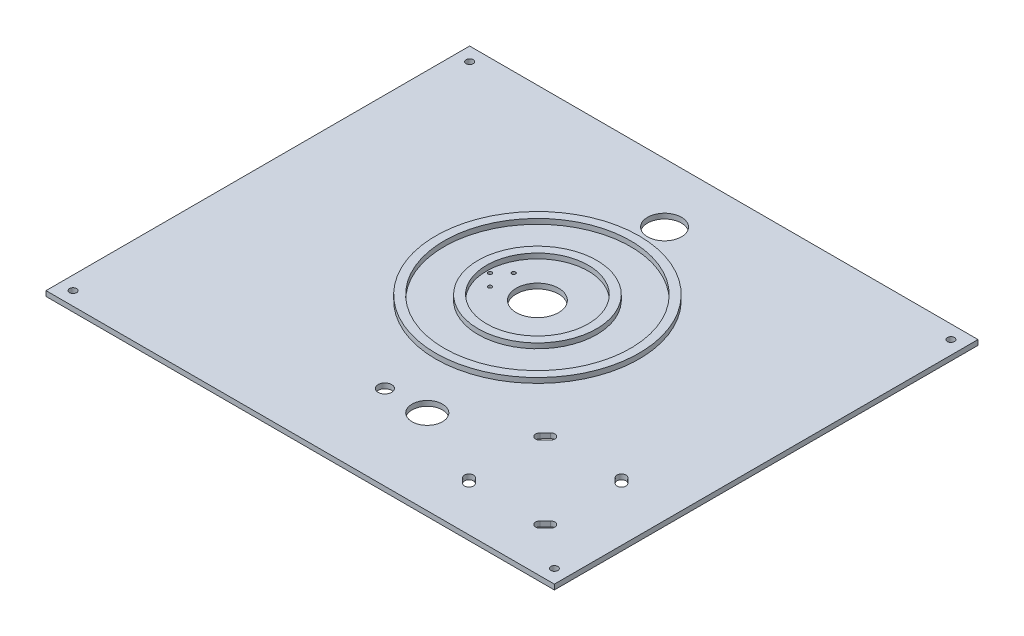
from build123d import *

# Parameters (mm, degrees)
SKETCH1_W           = 300
SKETCH1_H           = 220
BOSS_EXTRUDE1_DEPTH = 3
SKETCH2_R           = 12.5
CUT_EXTRUDE1_DEPTH  = 3
SKETCH3_R           = 60
SKETCH3_R_2         = 55
SKETCH3_R_3         = 35
SKETCH3_R_4         = 30
BOSS_EXTRUDE2_DEPTH = 3
CUT_EXTRUDE2_REACH  = 188.107
SKETCH4_R           = 1.1
CUT_EXTRUDE3_REACH  = 188.035
SKETCH5_R           = 10
SKETCH6_W           = 300
SKETCH6_H           = 30
BOSS_EXTRUDE3_DEPTH = 3
CUT_EXTRUDE4_REACH  = 207.205
SKETCH7_R           = 2.1
CUT_EXTRUDE5_REACH  = 207.205
CUT_EXTRUDE6_REACH  = 207.205
SKETCH10_R          = 4
SKETCH10_R_2        = 9


with BuildPart() as part:
    # Sketch1 → Boss-Extrude1 (new body)
    with BuildSketch(Plane(origin=(0, 0, 0), x_dir=(1, 0, 0), z_dir=(0, 1, 0))):
        Rectangle(SKETCH1_W, SKETCH1_H)
    extrude(amount=BOSS_EXTRUDE1_DEPTH)

    # Sketch2 → Cut-Extrude1 (cut)
    with BuildSketch(Plane(origin=(0, 3, 0), x_dir=(1, 0, 0), z_dir=(0, 1, 0))):
        with Locations(Location((0, 0, 0), (0, 0, 270))):
            Circle(SKETCH2_R)
    extrude(amount=-CUT_EXTRUDE1_DEPTH, mode=Mode.SUBTRACT)

    # Sketch3 → Boss-Extrude2 (add)
    # profile 1 of 2: a face of its own
    with BuildSketch(Plane(origin=(0, 3, 0), x_dir=(1, 0, 0), z_dir=(0, 1, 0))):
        with Locations(Location((0, 0, 0), (0, 0, 270))):
            Circle(SKETCH3_R)
        with Locations(Location((0, 0, 0), (0, 0, 270))):
            Circle(SKETCH3_R_2, mode=Mode.SUBTRACT)
    # profile 2 of 2: a face of its own
    with BuildSketch(Plane(origin=(0, 3, 0), x_dir=(1, 0, 0), z_dir=(0, 1, 0))):
        with Locations(Location((0, 0, 0), (0, 0, 270))):
            Circle(SKETCH3_R_3)
        with Locations(Location((0, 0, 0), (0, 0, 270))):
            Circle(SKETCH3_R_4, mode=Mode.SUBTRACT)
    extrude(amount=BOSS_EXTRUDE2_DEPTH)

    # Sketch4 → Cut-Extrude2 (cut, up to next)
    with BuildSketch(Plane.XZ, mode=Mode.PRIVATE) as cut_extrude2_sk1:
        with Locations(Location((-20.991491193, 7, 0), (0, 0, 270))):
            Circle(SKETCH4_R)
    cut_extrude2_tool1 = extrude(cut_extrude2_sk1.sketch, amount=-CUT_EXTRUDE2_REACH, mode=Mode.PRIVATE) & part.part
    # Sketch4 → Cut-Extrude2 (cut, up to next)
    with BuildSketch(Plane.XZ, mode=Mode.PRIVATE) as cut_extrude2_sk2:
        with Locations(Location((-27.991491193, 0, 0), (0, 0, 270))):
            Circle(SKETCH4_R)
    cut_extrude2_tool2 = extrude(cut_extrude2_sk2.sketch, amount=-CUT_EXTRUDE2_REACH, mode=Mode.PRIVATE) & part.part
    # Sketch4 → Cut-Extrude2 (cut, up to next)
    with BuildSketch(Plane.XZ, mode=Mode.PRIVATE) as cut_extrude2_sk3:
        with Locations(Location((-20.991491193, -7, 0), (0, 0, 270))):
            Circle(SKETCH4_R)
    cut_extrude2_tool3 = extrude(cut_extrude2_sk3.sketch, amount=-CUT_EXTRUDE2_REACH, mode=Mode.PRIVATE) & part.part
    add(cut_extrude2_tool1.solids().sort_by_distance((-20.991491, 0, 7))[0], mode=Mode.SUBTRACT)
    add(cut_extrude2_tool2.solids().sort_by_distance((-27.991491, 0, 0))[0], mode=Mode.SUBTRACT)
    add(cut_extrude2_tool3.solids().sort_by_distance((-20.991491, 0, -7))[0], mode=Mode.SUBTRACT)

    # Sketch5 → Cut-Extrude3 (cut, up to next)
    with BuildSketch(Plane(origin=(0, 3, 0), x_dir=(1, 0, 0), z_dir=(0, 1, 0)), mode=Mode.PRIVATE) as cut_extrude3_sk1:
        with Locations(Location((0, 75, 0), (0, 0, 270))):
            Circle(SKETCH5_R)
    cut_extrude3_tool1 = extrude(cut_extrude3_sk1.sketch, amount=-CUT_EXTRUDE3_REACH, mode=Mode.PRIVATE) & part.part
    add(cut_extrude3_tool1.solids().sort_by_distance((0, 3, -75))[0], mode=Mode.SUBTRACT)

    # Sketch6 → Boss-Extrude3 (add)
    with BuildSketch(Plane(origin=(0, 3, 0), x_dir=(1, 0, 0), z_dir=(0, 1, 0))):
        with Locations((0, -125)):
            Rectangle(SKETCH6_W, SKETCH6_H)
    extrude(amount=-BOSS_EXTRUDE3_DEPTH)

    # Sketch7 → Cut-Extrude4 (cut, up to next)
    with BuildSketch(Plane(origin=(0, 3, 0), x_dir=(1, 0, 0), z_dir=(0, 1, 0)), mode=Mode.PRIVATE) as cut_extrude4_sk1:
        with Locations(Location((-142, 102, 0), (0, 0, 270))):
            Circle(SKETCH7_R)
    cut_extrude4_tool1 = extrude(cut_extrude4_sk1.sketch, amount=-CUT_EXTRUDE4_REACH, mode=Mode.PRIVATE) & part.part
    # Sketch7 → Cut-Extrude4 (cut, up to next)
    with BuildSketch(Plane(origin=(0, 3, 0), x_dir=(1, 0, 0), z_dir=(0, 1, 0)), mode=Mode.PRIVATE) as cut_extrude4_sk2:
        with Locations(Location((142, 102, 0), (0, 0, 270))):
            Circle(SKETCH7_R)
    cut_extrude4_tool2 = extrude(cut_extrude4_sk2.sketch, amount=-CUT_EXTRUDE4_REACH, mode=Mode.PRIVATE) & part.part
    # Sketch7 → Cut-Extrude4 (cut, up to next)
    with BuildSketch(Plane(origin=(0, 3, 0), x_dir=(1, 0, 0), z_dir=(0, 1, 0)), mode=Mode.PRIVATE) as cut_extrude4_sk3:
        with Locations(Location((142, -132, 0), (0, 0, 270))):
            Circle(SKETCH7_R)
    cut_extrude4_tool3 = extrude(cut_extrude4_sk3.sketch, amount=-CUT_EXTRUDE4_REACH, mode=Mode.PRIVATE) & part.part
    # Sketch7 → Cut-Extrude4 (cut, up to next)
    with BuildSketch(Plane(origin=(0, 3, 0), x_dir=(1, 0, 0), z_dir=(0, 1, 0)), mode=Mode.PRIVATE) as cut_extrude4_sk4:
        with Locations(Location((-142, -132, 0), (0, 0, 270))):
            Circle(SKETCH7_R)
    cut_extrude4_tool4 = extrude(cut_extrude4_sk4.sketch, amount=-CUT_EXTRUDE4_REACH, mode=Mode.PRIVATE) & part.part
    add(cut_extrude4_tool1.solids().sort_by_distance((-142, 3, -102))[0], mode=Mode.SUBTRACT)
    add(cut_extrude4_tool2.solids().sort_by_distance((142, 3, -102))[0], mode=Mode.SUBTRACT)
    add(cut_extrude4_tool3.solids().sort_by_distance((142, 3, 132))[0], mode=Mode.SUBTRACT)
    add(cut_extrude4_tool4.solids().sort_by_distance((-142, 3, 132))[0], mode=Mode.SUBTRACT)

    # Sketch9 → Cut-Extrude5 (cut, up to next)
    with BuildSketch(Plane(origin=(0, 3, 0), x_dir=(1, 0, 0), z_dir=(0, 1, 0)), mode=Mode.PRIVATE) as cut_extrude5_sk1:
        with BuildLine():
            Line((75.252149951, -67.516466644), (72.271396026, -70.624077628))
            ThreePointArc((72.271396026, -70.624077628), (68.544792703, -70.701725066), (68.467145265, -66.975121742))
            Line((68.467145265, -66.975121742), (71.44789919, -63.867510758))
            ThreePointArc((71.44789919, -63.867510758), (75.174502513, -63.78986332), (75.252149951, -67.516466644))
        make_face()
    cut_extrude5_tool1 = extrude(cut_extrude5_sk1.sketch, amount=-CUT_EXTRUDE5_REACH, mode=Mode.PRIVATE) & part.part
    # Sketch9 → Cut-Extrude5 (cut, up to next)
    with BuildSketch(Plane(origin=(0, 3, 0), x_dir=(1, 0, 0), z_dir=(0, 1, 0)), mode=Mode.PRIVATE) as cut_extrude5_sk2:
        with BuildLine():
            Line((72.232976728, -108.891711148), (75.213730653, -111.872465073))
            ThreePointArc((75.213730653, -111.872465073), (75.213730653, -115.599877238), (71.486318487, -115.599877238))
            Line((71.486318487, -115.599877238), (68.505564562, -112.619123313))
            ThreePointArc((68.505564562, -112.619123313), (68.505564562, -108.891711148), (72.232976728, -108.891711148))
        make_face()
    cut_extrude5_tool2 = extrude(cut_extrude5_sk2.sketch, amount=-CUT_EXTRUDE5_REACH, mode=Mode.PRIVATE) & part.part
    # Sketch9 → Cut-Extrude5 (cut, up to next)
    with BuildSketch(Plane(origin=(0, 3, 0), x_dir=(1, 0, 0), z_dir=(0, 1, 0)), mode=Mode.PRIVATE) as cut_extrude5_sk3:
        with BuildLine():
            Line((120.245775281, -112.587078686), (117.2009321, -115.631921866))
            ThreePointArc((117.2009321, -115.631921866), (113.473519935, -115.631921866), (113.473519935, -111.9045097))
            Line((113.473519935, -111.9045097), (116.518363115, -108.85966652))
            ThreePointArc((116.518363115, -108.85966652), (120.245775281, -108.85966652), (120.245775281, -112.587078686))
        make_face()
    cut_extrude5_tool3 = extrude(cut_extrude5_sk3.sketch, amount=-CUT_EXTRUDE5_REACH, mode=Mode.PRIVATE) & part.part
    # Sketch9 → Cut-Extrude5 (cut, up to next)
    with BuildSketch(Plane(origin=(0, 3, 0), x_dir=(1, 0, 0), z_dir=(0, 1, 0)), mode=Mode.PRIVATE) as cut_extrude5_sk4:
        with BuildLine():
            Line((117.2009321, -63.85966652), (120.245775281, -66.9045097))
            ThreePointArc((120.245775281, -66.9045097), (120.245775281, -70.631921866), (116.518363115, -70.631921866))
            Line((116.518363115, -70.631921866), (113.473519935, -67.587078686))
            ThreePointArc((113.473519935, -67.587078686), (113.473519935, -63.85966652), (117.2009321, -63.85966652))
        make_face()
    cut_extrude5_tool4 = extrude(cut_extrude5_sk4.sketch, amount=-CUT_EXTRUDE5_REACH, mode=Mode.PRIVATE) & part.part
    add(cut_extrude5_tool1.solids().sort_by_distance((71.859648, 3, 67.245794))[0], mode=Mode.SUBTRACT)
    add(cut_extrude5_tool2.solids().sort_by_distance((71.859648, 3, 112.245794))[0], mode=Mode.SUBTRACT)
    add(cut_extrude5_tool3.solids().sort_by_distance((116.859648, 3, 112.245794))[0], mode=Mode.SUBTRACT)
    add(cut_extrude5_tool4.solids().sort_by_distance((116.859648, 3, 67.245794))[0], mode=Mode.SUBTRACT)

    # Sketch10 → Cut-Extrude6 (cut, up to next)
    with BuildSketch(Plane(origin=(0, 3, 0), x_dir=(1, 0, 0), z_dir=(0, 1, 0)), mode=Mode.PRIVATE) as cut_extrude6_sk1:
        with Locations(Location((0, -90, 0), (0, 0, 270))):
            Circle(SKETCH10_R)
    cut_extrude6_tool1 = extrude(cut_extrude6_sk1.sketch, amount=-CUT_EXTRUDE6_REACH, mode=Mode.PRIVATE) & part.part
    # Sketch10 → Cut-Extrude6 (cut, up to next)
    with BuildSketch(Plane(origin=(0, 3, 0), x_dir=(1, 0, 0), z_dir=(0, 1, 0)), mode=Mode.PRIVATE) as cut_extrude6_sk2:
        with Locations(Location((25, -90, 0), (0, 0, 270))):
            Circle(SKETCH10_R_2)
    cut_extrude6_tool2 = extrude(cut_extrude6_sk2.sketch, amount=-CUT_EXTRUDE6_REACH, mode=Mode.PRIVATE) & part.part
    add(cut_extrude6_tool1.solids().sort_by_distance((0, 3, 90))[0], mode=Mode.SUBTRACT)
    add(cut_extrude6_tool2.solids().sort_by_distance((25, 3, 90))[0], mode=Mode.SUBTRACT)


solid = part.part
